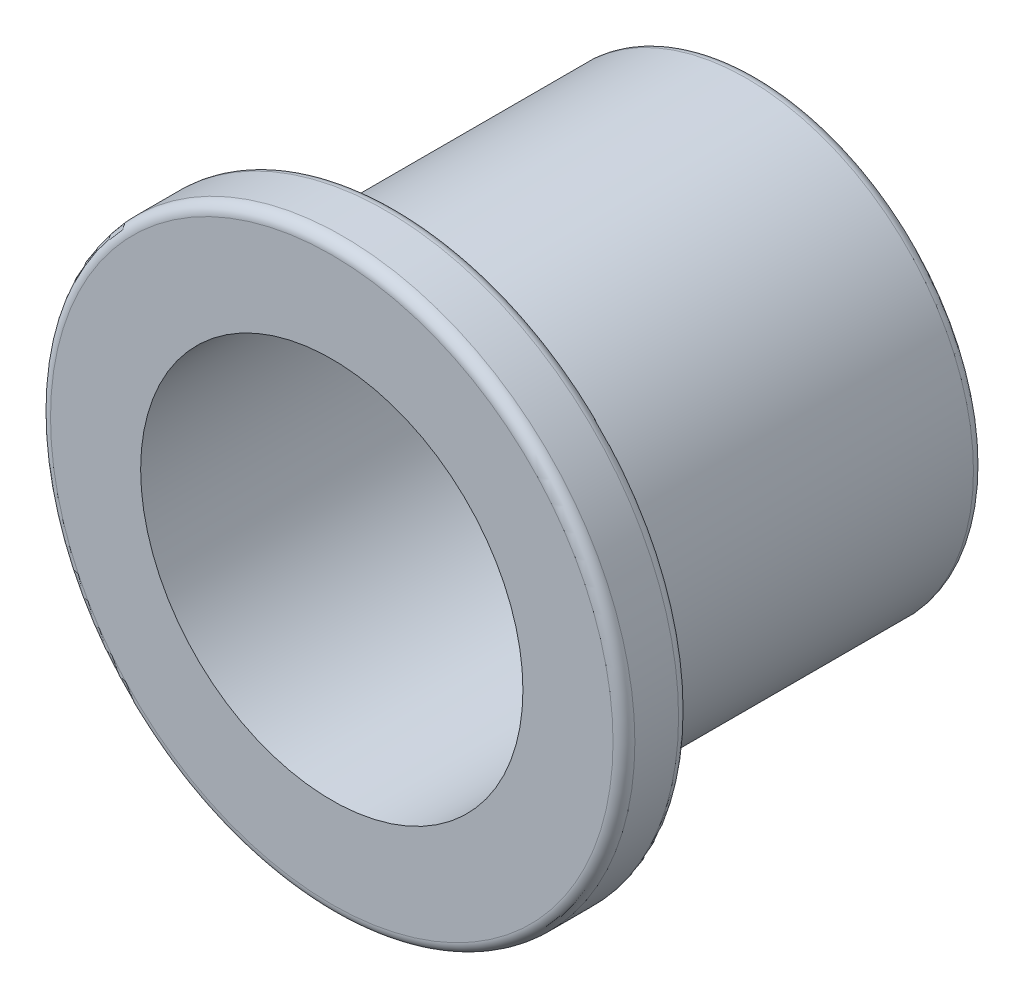
from build123d import *

# Parameters (mm, degrees)
CROQUIS1_W            = 5.35
CROQUIS1_H            = 7.8
CROQUIS4_R            = 3.5
CORTAR_EXTRUIR1_DEPTH = 8
CROQUIS3_W            = 1.2
CROQUIS3_H            = 6.6
REDONDEO1_R           = 0.2
REDONDEO2_R           = 0.2
REDONDEO3_R           = 0.2


with BuildPart() as part:
    # Croquis1 → Revolución1 (revolve)
    with BuildSketch(Plane(origin=(0, 0, 0), x_dir=(1, 0, 0), z_dir=(0, 1, 0))):
        with Locations((2.675, 3.9)):
            Rectangle(CROQUIS1_W, CROQUIS1_H)
    revolve(axis=Axis((0, 0, 0), (0, 0, -1)))

    # Croquis4 → Cortar-Extruir1 (cut)
    with BuildSketch(Plane(origin=(0, 0, -7.8), x_dir=(-1, 0, 0), z_dir=(0, 0, -1))):
        Circle(CROQUIS4_R)
    extrude(amount=-CORTAR_EXTRUIR1_DEPTH, mode=Mode.SUBTRACT)

    # Croquis3 → Cortar-Revolución1 (revolve, cut)
    with BuildSketch(Plane(origin=(0, 0, 0), x_dir=(1, 0, 0), z_dir=(0, 1, 0))):
        with Locations((4.75, 4.5)):
            Rectangle(CROQUIS3_W, CROQUIS3_H)
    revolve(axis=Axis((0, 0, -1.2), (0, 0, -1)), mode=Mode.SUBTRACT)

    # Redondeo1
    redondeo1_edges = [part.edges().sort_by_distance(p)[0] for p in [
        (-4.15, 0, -7.8),
    ]]
    fillet(redondeo1_edges, radius=REDONDEO1_R)

    # Redondeo2
    redondeo2_edges = [part.edges().sort_by_distance(p)[0] for p in [
        (-4.15, 0, -1.2),
    ]]
    fillet(redondeo2_edges, radius=REDONDEO2_R)

    # Redondeo3
    redondeo3_edges = [part.edges().sort_by_distance(p)[0] for p in [
        (-5.35, 0, -1.2),
        (-5.35, 0, 0),
    ]]
    fillet(redondeo3_edges, radius=REDONDEO3_R)


solid = part.part
